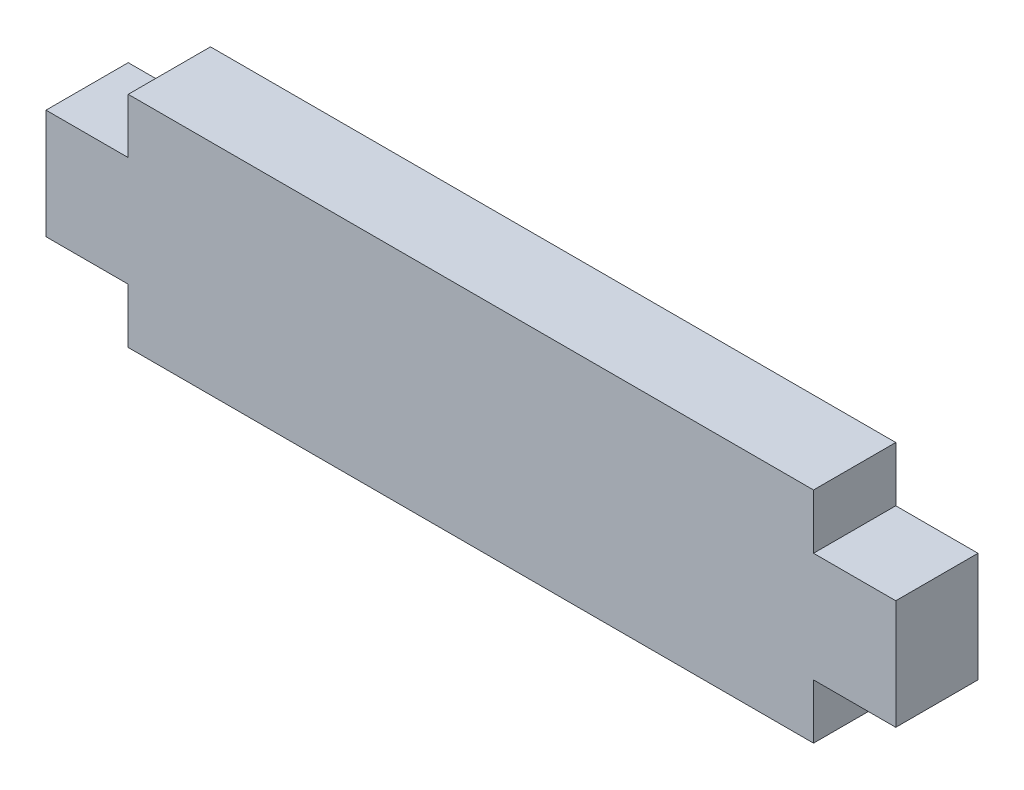
from build123d import *

# Parameters (mm, degrees)
BOSS_EXTRU_1_DEPTH = 6


with BuildPart() as part:
    # Esquisse1 → Boss.-Extru.1 (new body)
    with BuildSketch(Plane.XY):
        Polygon((0, 0), (0, 4), (-6, 4), (-6, 12), (0, 12), (0, 16), (50, 16), (50, 12), (56, 12), (56, 4), (50, 4), (50, 0), align=None)
    extrude(amount=BOSS_EXTRU_1_DEPTH)


solid = part.part
